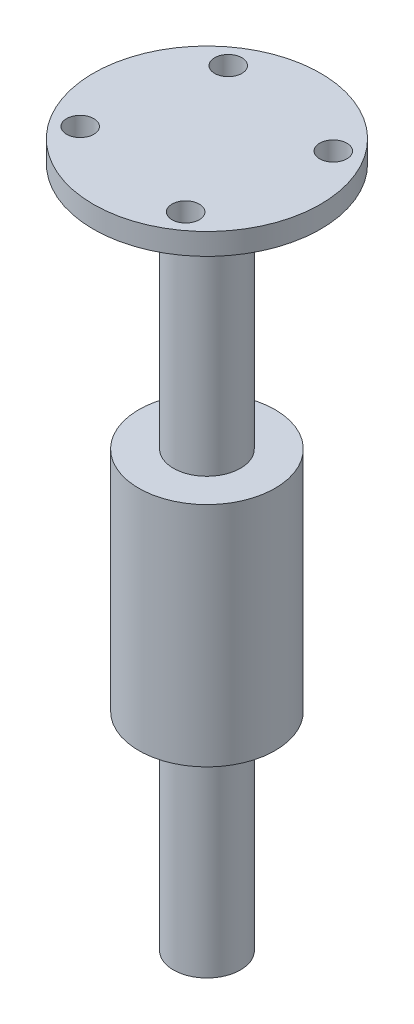
from build123d import *

# Parameters (mm, degrees)
ESQUISSE1_R             = 2.95
BOSS_EXTRU_1_DEPTH      = 60
ESQUISSE2_R             = 10
BOSS_EXTRU_2_DEPTH      = 3
ESQUISSE3_R             = 1.2
ENL_V_MAT_EXTRU_1_DEPTH = 10
ESQUISSE4_R             = 10
ESQUISSE4_R_2           = 1.2
ENL_V_MAT_EXTRU_2_DEPTH = 1.1
ESQUISSE5_R             = 6
BOSS_EXTRU_3_DEPTH      = 20


with BuildPart() as part:
    # Esquisse1 → Boss.-Extru.1 (new body)
    with BuildSketch(Plane(origin=(0, 0, 0), x_dir=(1, 0, 0), z_dir=(0, 1, 0))):
        with Locations(Location((0, 0, 0), (0, 0, 270))):
            Circle(ESQUISSE1_R)
    extrude(amount=BOSS_EXTRU_1_DEPTH)

    # Esquisse2 → Boss.-Extru.2 (add)
    with BuildSketch(Plane(origin=(0, 60, 0), x_dir=(1, 0, 0), z_dir=(0, 1, 0))):
        with Locations(Location((0, 0, 0), (0, 0, 270))):
            Circle(ESQUISSE2_R)
    extrude(amount=BOSS_EXTRU_2_DEPTH)

    # Esquisse3 → Enlèv. mat.-Extru.1 (cut)
    with BuildSketch(Plane(origin=(0, 63, 0), x_dir=(1, 0, 0), z_dir=(0, 1, 0))):
        with BuildLine():
            ThreePointArc((-5.538612634, -3.945094433), (-7.212207999, -3.663885339), (-7.493417094, -5.337480704))
            Line((-7.493417094, -5.337480704), (-6.516014864, -4.641287568))
            Line((-6.516014864, -4.641287568), (-5.538612634, -3.945094433))
        make_face()
        with BuildLine():
            Line((-6.516014864, -4.641287568), (-7.493417094, -5.337480704))
            ThreePointArc((-7.493417094, -5.337480704), (-6.150558078, -5.784284216), (-5.316014864, -4.641287568))
            ThreePointArc((-5.316014864, -4.641287568), (-5.373018216, -4.275830783), (-5.538612634, -3.945094433))
            Line((-5.538612634, -3.945094433), (-6.516014864, -4.641287568))
        make_face()
        with BuildLine():
            ThreePointArc((-3.441287568, 6.516014864), (-4.091483859, 7.582652516), (-5.337480704, 7.493417094))
            Line((-5.337480704, 7.493417094), (-4.641287568, 6.516014864))
            Line((-4.641287568, 6.516014864), (-3.945094433, 5.538612634))
            ThreePointArc((-3.945094433, 5.538612634), (-3.574649916, 5.966211155), (-3.441287568, 6.516014864))
        make_face()
        with BuildLine():
            Line((-4.641287568, 6.516014864), (-5.337480704, 7.493417094))
            ThreePointArc((-5.337480704, 7.493417094), (-5.618689798, 5.819821729), (-3.945094433, 5.538612634))
            Line((-3.945094433, 5.538612634), (-4.641287568, 6.516014864))
        make_face()
        with BuildLine():
            ThreePointArc((3.945094433, -5.538612634), (3.663885339, -7.212207999), (5.337480704, -7.493417094))
            Line((5.337480704, -7.493417094), (4.641287568, -6.516014864))
            Line((4.641287568, -6.516014864), (3.945094433, -5.538612634))
        make_face()
        with BuildLine():
            Line((4.641287568, -6.516014864), (5.337480704, -7.493417094))
            ThreePointArc((5.337480704, -7.493417094), (5.707925221, -7.065818573), (5.841287568, -6.516014864))
            ThreePointArc((5.841287568, -6.516014864), (5.191091278, -5.449377212), (3.945094433, -5.538612634))
            Line((3.945094433, -5.538612634), (4.641287568, -6.516014864))
        make_face()
        with Locations(Location((6.495771182, 4.62686821, 0), (0, 0, 270))):
            Circle(ESQUISSE3_R)
    extrude(amount=-ENL_V_MAT_EXTRU_1_DEPTH, mode=Mode.SUBTRACT)

    # Esquisse4 → Enlèv. mat.-Extru.2 (cut)
    with BuildSketch(Plane(origin=(0, 63, 0), x_dir=(1, 0, 0), z_dir=(0, 1, 0))):
        with Locations(Location((0, 0, 0), (0, 0, 270))):
            Circle(ESQUISSE4_R)
        with Locations(Location((4.641287568, -6.516014864, 0), (0, 0, 270))):
            Circle(ESQUISSE4_R_2, mode=Mode.SUBTRACT)
        with Locations(Location((-6.516014864, -4.641287568, 0), (0, 0, 270))):
            Circle(ESQUISSE4_R_2, mode=Mode.SUBTRACT)
        with Locations(Location((6.495771182, 4.62686821, 0), (0, 0, 270))):
            Circle(ESQUISSE4_R_2, mode=Mode.SUBTRACT)
        with Locations(Location((-4.641287568, 6.516014864, 0), (0, 0, 270))):
            Circle(ESQUISSE4_R_2, mode=Mode.SUBTRACT)
    extrude(amount=-ENL_V_MAT_EXTRU_2_DEPTH, mode=Mode.SUBTRACT)

    # Esquisse5 → Boss.-Extru.3 (add)
    with BuildSketch(Plane(origin=(0, 38.25, 0), x_dir=(-1, 0, 0), z_dir=(0, -1, 0))):
        with Locations(Location((0, 0, 0), (0, 0, 90))):
            Circle(ESQUISSE5_R)
    extrude(amount=BOSS_EXTRU_3_DEPTH)


solid = part.part
